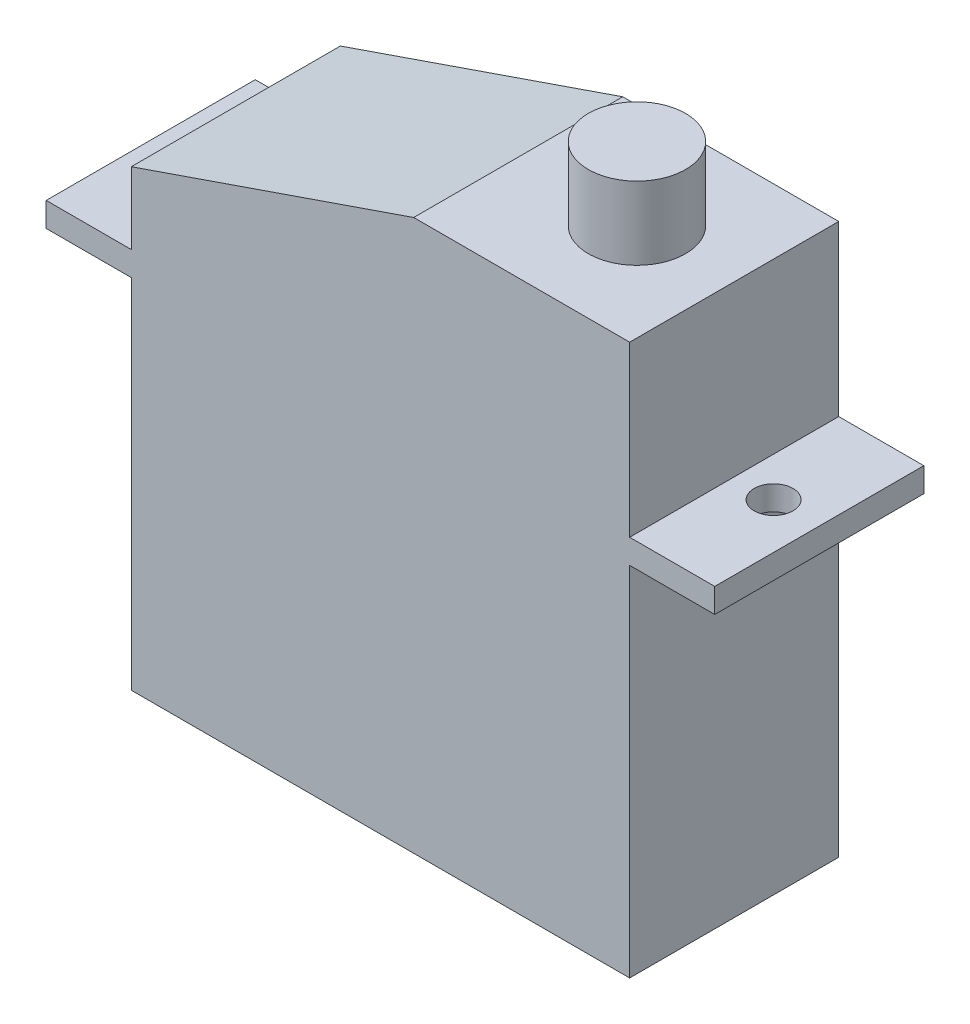
from build123d import *

# Parameters (mm, degrees)
SKETCH_1_W          = 20.5
SKETCH_1_H          = 8.6
EXTRUDE_1_DEPTH     = 15.2
SKETCH_2_W          = 20.5
SKETCH_2_H          = 7.45
EXTRUDE_2_DEPTH     = 8.6
CHAMFER_1_SIZE      = 4
CHAMFER_1_SIZE2     = 11.616843511
SKETCH_3_W          = 3.5
SKETCH_3_H          = 1
EXTRUDE_3_DEPTH     = 8.6
SKETCH_4_R          = 0.8
CUT_EXTRUDE_1_DEPTH = 8.6
SKETCH_5_R          = 2
EXTRUDE_4_DEPTH     = 3


with BuildPart() as part:
    # 草图1 → 凸台-拉伸1 (new body)
    with BuildSketch(Plane(origin=(0, 0, 0), x_dir=(1, 0, 0), z_dir=(0, 1, 0))):
        with Locations((10.25, 4.3)):
            Rectangle(SKETCH_1_W, SKETCH_1_H)
    extrude(amount=EXTRUDE_1_DEPTH)

    # 草图2 → 凸台-拉伸2 (add)
    with BuildSketch(Plane.XY):
        with Locations((10.25, 18.925)):
            Rectangle(SKETCH_2_W, SKETCH_2_H)
    extrude(amount=-EXTRUDE_2_DEPTH)

    # 倒角1
    chamfer_1_edges = [part.edges().sort_by_distance(p)[0] for p in [
        (0, 22.65, -4.3),
    ]]
    chamfer_1_side = [part.faces().sort_by_distance(p)[0] for p in [
        (0, 11.325, -4.3),
    ]]
    chamfer(chamfer_1_edges, length=CHAMFER_1_SIZE, length2=CHAMFER_1_SIZE2, reference=chamfer_1_side[0])

    # 草图3 → 凸台-拉伸3 (add)
    with BuildSketch(Plane.XY):
        with Locations((-1.75, 15.2)):
            Rectangle(SKETCH_3_W, SKETCH_3_H)
        with Locations((22.25, 15.2)):
            Rectangle(SKETCH_3_W, SKETCH_3_H)
    extrude(amount=-EXTRUDE_3_DEPTH)

    # 草图4 → 切除-拉伸1 (cut)
    with BuildSketch(Plane(origin=(0, 15.7, 0), x_dir=(1, 0, 0), z_dir=(0, 1, 0))):
        with Locations(Location((-1.62, 4.3, 0), (0, 0, 180))):
            Circle(SKETCH_4_R)
        with Locations(Location((22.12, 4.3, 0), (0, 0, 180))):
            Circle(SKETCH_4_R)
    extrude(amount=-CUT_EXTRUDE_1_DEPTH, mode=Mode.SUBTRACT)

    # 草图5 → 凸台-拉伸4 (add)
    with BuildSketch(Plane(origin=(0, 22.65, 0), x_dir=(1, 0, 0), z_dir=(0, 1, 0))):
        with Locations(Location((16.5, 4.3, 0), (0, 0, 180))):
            Circle(SKETCH_5_R)
    extrude(amount=EXTRUDE_4_DEPTH)


solid = part.part
